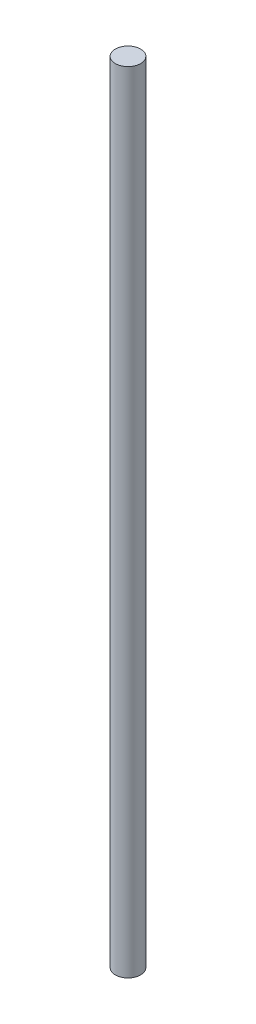
from build123d import *

# Parameters (mm, degrees)
SKETCH1_R           = 4
BOSS_EXTRUDE1_DEPTH = 250


with BuildPart() as part:
    # Sketch1 → Boss-Extrude1 (new body)
    with BuildSketch(Plane(origin=(0, 0, 0), x_dir=(1, 0, 0), z_dir=(0, 1, 0))):
        with Locations(Location((0, 0, 0), (0, 0, 270))):
            Circle(SKETCH1_R)
    extrude(amount=BOSS_EXTRUDE1_DEPTH)


solid = part.part
